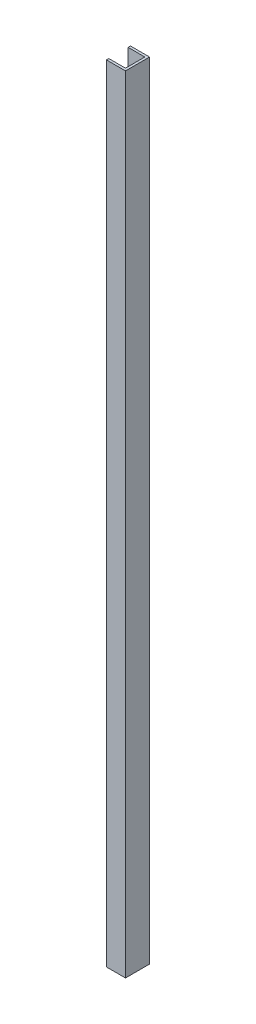
from build123d import *

# Parameters (mm, degrees)
SIDE_CHANNEL_DEPTH = 261.97


with BuildPart() as part:
    # side channel sketch → side channel (new, symmetric)
    with BuildSketch(Plane(origin=(0, 0, 0), x_dir=(1, 0, 0), z_dir=(0, 1, 0))):
        Polygon((154.32, -13.83), (167.02, -13.83), (167.02, -29.87), (154.32, -29.87), (154.32, -28.3), (165.45, -28.3), (165.45, -15.4), (154.32, -15.4), align=None)
    extrude(amount=SIDE_CHANNEL_DEPTH, both=True)


solid = part.part
